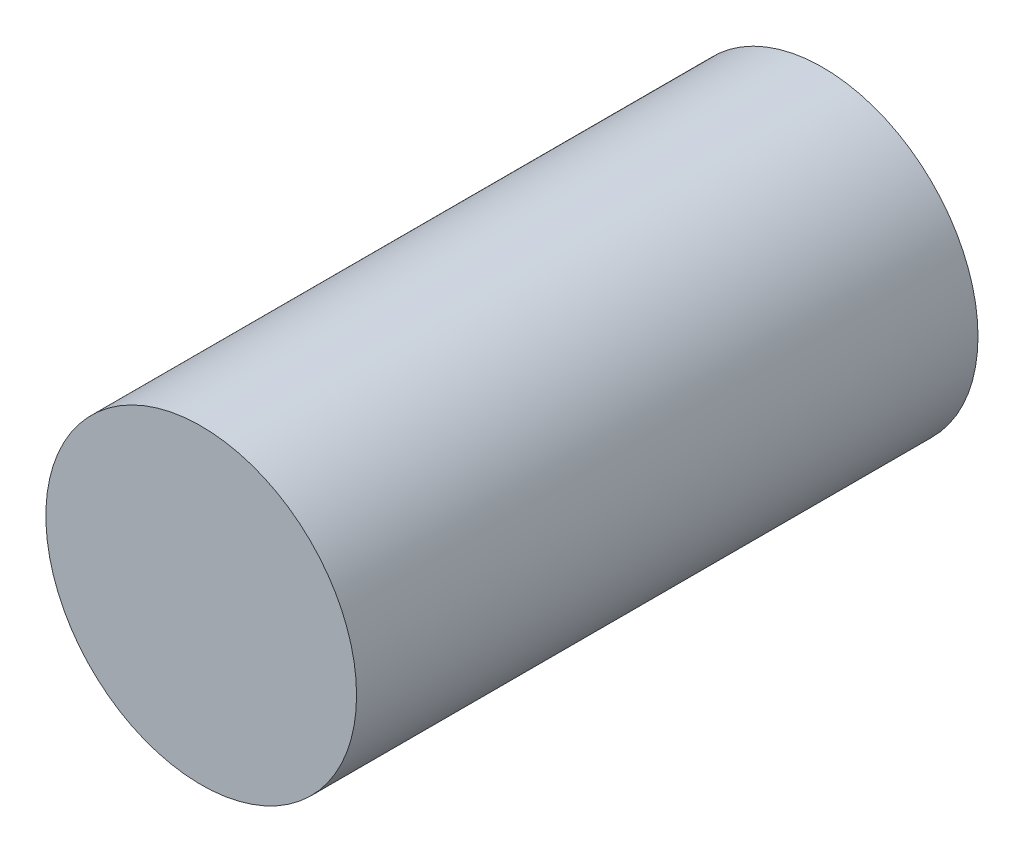
from build123d import *

# Parameters (mm, degrees)
ESQUISSE1_R        = 27.5
BOSS_EXTRU_1_DEPTH = 55


with BuildPart() as part:
    # Esquisse1 → Boss.-Extru.1 (new, symmetric)
    with BuildSketch(Plane.XY):
        Circle(ESQUISSE1_R)
    extrude(amount=BOSS_EXTRU_1_DEPTH, both=True)


solid = part.part
